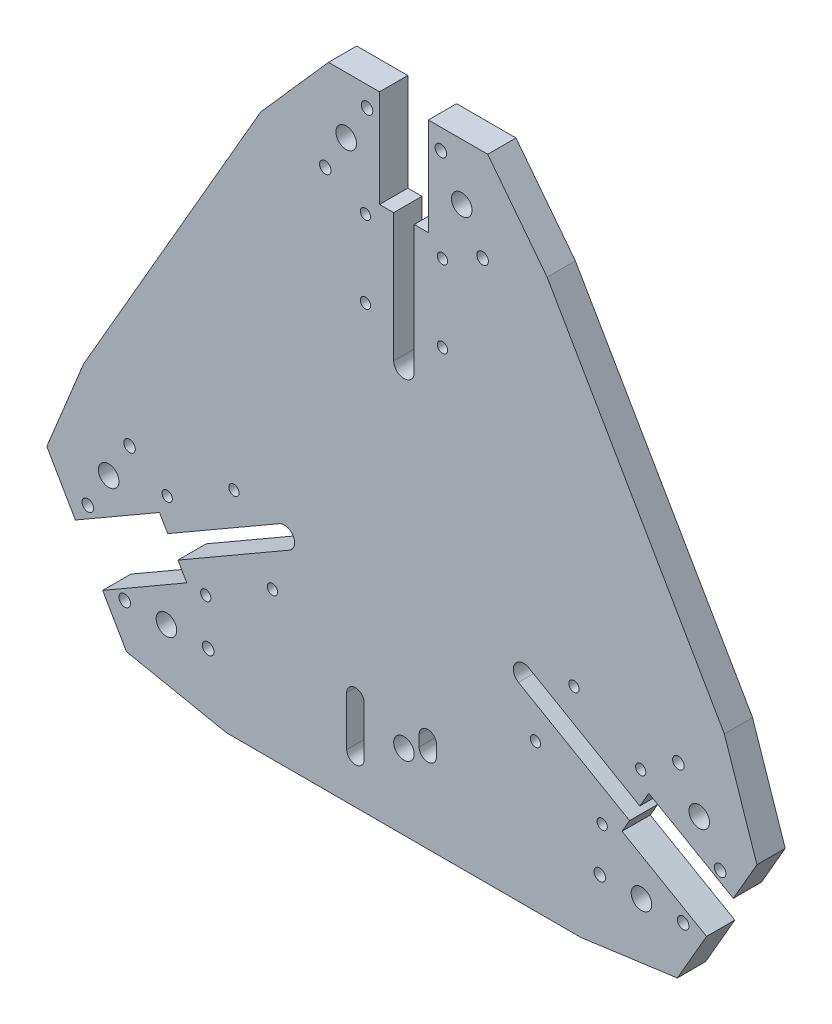
from build123d import *

# Parameters (mm, degrees)
ESQUISSE1_R        = 2
ESQUISSE1_R_2      = 4
ESQUISSE1_R_3      = 2.25
BOSS_EXTRU_1_DEPTH = 11


with BuildPart() as part:
    # Esquisse1 → Boss.-Extru.1 (new body)
    with BuildSketch(Plane.XY):
        with BuildLine():
            Line((55.7582898, 111.889394822), (124.778203229, -7.656601971))
            Line((124.778203229, -7.656601971), (137.475849877, -45.428957942))
            Line((137.475849877, -45.428957942), (128.262549161, -61.386862887))
            Line((128.262549161, -61.386862887), (95.353583818, -42.386862887))
            Line((95.353583818, -42.386862887), (91.869237886, -48.42192707))
            Line((91.869237886, -48.42192707), (48.59232335, -23.435988813))
            ThreePointArc((48.59232335, -23.435988813), (43.128221735, -24.900090428), (44.59232335, -30.364192044))
            Line((44.59232335, -30.364192044), (87.869237886, -55.350130301))
            Line((87.869237886, -55.350130301), (84.941034656, -60.42192707))
            Line((84.941034656, -60.42192707), (117.85, -79.42192707))
            Line((117.85, -79.42192707), (106.4683565, -99.135511886))
            Line((106.4683565, -99.135511886), (69.01991343, -104.23279285))
            Line((69.01991343, -104.23279285), (-69.019913428, -104.23279285))
            Line((-69.019913428, -104.23279285), (-108.080556584, -96.343099429))
            Line((-108.080556584, -96.343099429), (-117.340438531, -80.304513424))
            Line((-117.340438531, -80.304513424), (-84.574106641, -61.386862887))
            Line((-84.574106641, -61.386862887), (-88.01187134, -55.432479764))
            Line((-88.01187134, -55.432479764), (-44.59232335, -30.364192044))
            ThreePointArc((-44.59232335, -30.364192044), (-43.128221735, -24.900090428), (-48.59232335, -23.435988813))
            Line((-48.59232335, -23.435988813), (-92.01187134, -48.504276533))
            Line((-92.01187134, -48.504276533), (-95.205458711, -42.972820948))
            Line((-95.205458711, -42.972820948), (-127.971790601, -61.890471485))
            Line((-127.971790601, -61.890471485), (-139.088049961, -42.636545485))
            Line((-139.088049961, -42.636545485), (-124.77820323, -7.656601972))
            Line((-124.77820323, -7.656601972), (-55.758289801, 111.889394821))
            Line((-55.758289801, 111.889394821), (-29.395293293, 141.772057371))
            Line((-29.395293293, 141.772057371), (-9.5, 141.772057371))
            Line((-9.5, 141.772057371), (-9.5, 103.772057371))
            Line((-9.5, 103.772057371), (-4, 103.772057371))
            Line((-4, 103.772057371), (-4, 53.800180857))
            ThreePointArc((-4, 53.800180857), (0, 49.800180857), (4, 53.800180857))
            Line((4, 53.800180857), (4, 103.772057371))
            Line((4, 103.772057371), (9.5, 103.772057371))
            Line((9.5, 103.772057371), (9.5, 141.772057371))
            Line((9.5, 141.772057371), (32.619693461, 141.772057371))
            Line((32.619693461, 141.772057371), (55.7582898, 111.889394822))
        make_face()
        with Locations((-92.197441117, -35.909709372)):
            Circle(ESQUISSE1_R, mode=Mode.SUBTRACT)
        with Locations((-66.216679003, -20.909709372)):
            Circle(ESQUISSE1_R, mode=Mode.SUBTRACT)
        with Locations((-51.216679003, -46.890471485)):
            Circle(ESQUISSE1_R, mode=Mode.SUBTRACT)
        with Locations((-77.197441117, -61.890471485)):
            Circle(ESQUISSE1_R, mode=Mode.SUBTRACT)
        with Locations((-15, 97.800180857)):
            Circle(ESQUISSE1_R, mode=Mode.SUBTRACT)
        with Locations((-15, 67.800180857)):
            Circle(ESQUISSE1_R, mode=Mode.SUBTRACT)
        with Locations((15, 67.800180857)):
            Circle(ESQUISSE1_R, mode=Mode.SUBTRACT)
        with Locations((15, 97.800180857)):
            Circle(ESQUISSE1_R, mode=Mode.SUBTRACT)
        with Locations((22.5, 119.800180857)):
            Circle(ESQUISSE1_R_2, mode=Mode.SUBTRACT)
        with Locations((-22.5, 119.800180857)):
            Circle(ESQUISSE1_R_2, mode=Mode.SUBTRACT)
        with Locations((-115, -40.414518843)):
            Circle(ESQUISSE1_R_2, mode=Mode.SUBTRACT)
        with Locations((-92.5, -79.385662014)):
            Circle(ESQUISSE1_R_2, mode=Mode.SUBTRACT)
        with Locations((92.5, -79.385662014)):
            Circle(ESQUISSE1_R_2, mode=Mode.SUBTRACT)
        with Locations((115, -40.414518843)):
            Circle(ESQUISSE1_R_2, mode=Mode.SUBTRACT)
        with Locations((92.197441117, -35.909709372)):
            Circle(ESQUISSE1_R, mode=Mode.SUBTRACT)
        with Locations((66.216679003, -20.909709372)):
            Circle(ESQUISSE1_R, mode=Mode.SUBTRACT)
        with Locations((51.216679003, -46.890471485)):
            Circle(ESQUISSE1_R, mode=Mode.SUBTRACT)
        with Locations((77.197441117, -61.890471485)):
            Circle(ESQUISSE1_R, mode=Mode.SUBTRACT)
        with Locations((0, -74.885662014)):
            Circle(ESQUISSE1_R_2, mode=Mode.SUBTRACT)
        with Locations((-76.25, -79.385662014)):
            Circle(ESQUISSE1_R_3, mode=Mode.SUBTRACT)
        with Locations((-108.75, -79.385662014)):
            Circle(ESQUISSE1_R_3, mode=Mode.SUBTRACT)
        with Locations(Location((-106.875, -26.341606032, 0), (0, 0, 180))):
            Circle(ESQUISSE1_R_3, mode=Mode.SUBTRACT)
        with Locations(Location((-123.125, -54.487431655, 0), (0, 0, 180))):
            Circle(ESQUISSE1_R_3, mode=Mode.SUBTRACT)
        with Locations(Location((14.375, 133.873093668, 0), (0, 0, 180))):
            Circle(ESQUISSE1_R_3, mode=Mode.SUBTRACT)
        with Locations(Location((30.625, 105.727268045, 0), (0, 0, 180))):
            Circle(ESQUISSE1_R_3, mode=Mode.SUBTRACT)
        with Locations((-14.375, 133.873093668)):
            Circle(ESQUISSE1_R_3, mode=Mode.SUBTRACT)
        with Locations((-30.625, 105.727268045)):
            Circle(ESQUISSE1_R_3, mode=Mode.SUBTRACT)
        with Locations(Location((108.75, -79.385662014, 0), (0, 0, 180))):
            Circle(ESQUISSE1_R_3, mode=Mode.SUBTRACT)
        with Locations(Location((76.25, -79.385662014, 0), (0, 0, 180))):
            Circle(ESQUISSE1_R_3, mode=Mode.SUBTRACT)
        with Locations((123.125, -54.487431655)):
            Circle(ESQUISSE1_R_3, mode=Mode.SUBTRACT)
        with Locations((106.875, -26.341606032)):
            Circle(ESQUISSE1_R_3, mode=Mode.SUBTRACT)
        with BuildLine():
            Line((-15.5, -67.285662014), (-15.5, -86.485662014))
            ThreePointArc((-15.5, -86.485662014), (-18.9, -89.885662014), (-22.3, -86.485662014))
            Line((-22.3, -86.485662014), (-22.3, -67.285662014))
            ThreePointArc((-22.3, -67.285662014), (-18.9, -63.885662014), (-15.5, -67.285662014))
        make_face(mode=Mode.SUBTRACT)
        with BuildLine():
            Line((12.7, -67.285662014), (12.7, -71.485662014))
            ThreePointArc((12.7, -71.485662014), (9.3, -74.885662014), (5.9, -71.485662014))
            Line((5.9, -71.485662014), (5.9, -67.285662014))
            ThreePointArc((5.9, -67.285662014), (9.3, -63.885662014), (12.7, -67.285662014))
        make_face(mode=Mode.SUBTRACT)
    extrude(amount=BOSS_EXTRU_1_DEPTH)


solid = part.part
